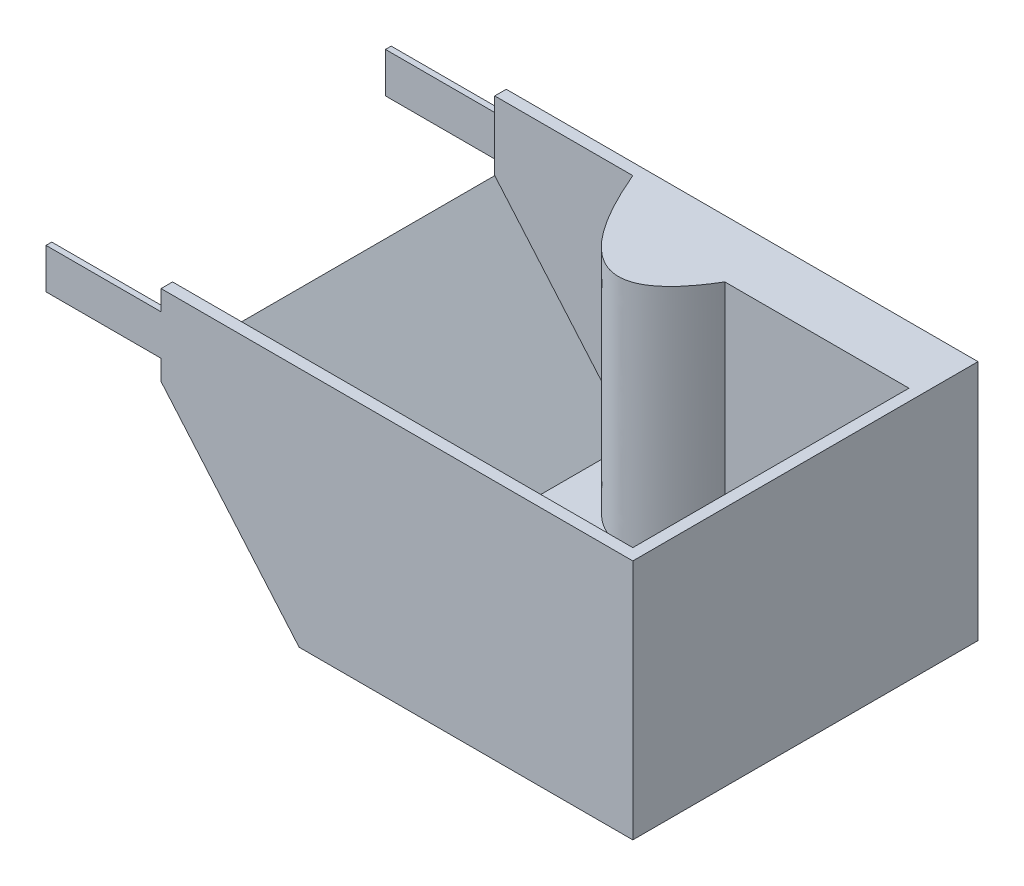
from build123d import *

# Parameters (mm, degrees)
SALIENTE_EXTRUIR1_DEPTH    = 105
SALIENTE_EXTRUIR2_DEPTH    = 5
CROQUIS3_W                 = 140
CROQUIS3_H                 = 105
SALIENTE_EXTRUIR3_DEPTH    = 5
CROQUIS4_W                 = 205
CROQUIS4_H                 = 105
SALIENTE_EXTRUIR5_DEPTH    = 5
CROQUIS5_W                 = 205
CROQUIS5_H                 = 105
SALIENTE_EXTRUIR6_DEPTH    = 5
SALIENTE_EXTRUIR7_DEPTH    = 140
CORTAR_EXTRUIR1_DEPTH      = 273.167228172
CORTAR_EXTRUIR1_DEPTH_BACK = 273.167228172
CROQUIS9_W                 = 70
CROQUIS9_H                 = 17.5
SALIENTE_EXTRUIR8_DEPTH    = 2.5
CROQUIS10_W                = 70
CROQUIS10_H                = 17.5
SALIENTE_EXTRUIR9_DEPTH    = 2.5
CORTAR_EXTRUIR2_START      = -5
CORTAR_EXTRUIR2_DEPTH      = 140


with BuildPart() as part:
    # Croquis2 → Saliente-Extruir1 (new body)
    with BuildSketch(Plane(origin=(0, 0, 0), x_dir=(1, 0, 0), z_dir=(0, 1, 0))):
        with BuildLine():
            Line((120, 70), (60, 70))
            add(Edge.make_bspline(
                [(60, 70), (89.76394683, -0.562785514), (120, 50)],
                knots=[0, 0, 0, 1, 1, 1], degree=2))
            Line((120, 50), (200, 50))
            Line((200, 50), (200, 70))
            Line((200, 70), (120, 70))
        make_face()
    extrude(amount=SALIENTE_EXTRUIR1_DEPTH)

    # Croquis2<3> → Saliente-Extruir2 (add)
    with BuildSketch(Plane(origin=(0, 0, 0), x_dir=(1, 0, 0), z_dir=(0, 1, 0))):
        with BuildLine():
            Line((60, 70), (60, -70))
            Line((60, -70), (200, -70))
            Line((200, -70), (200, 50))
            Line((200, 50), (120, 50))
            add(Edge.make_bspline(
                [(60, 70), (89.76394683, -0.562785514), (120, 50)],
                knots=[0, 0, 0, 1, 1, 1], degree=2))
        make_face()
    extrude(amount=SALIENTE_EXTRUIR2_DEPTH)

    # Croquis3 → Saliente-Extruir3 (add)
    with BuildSketch(Plane(origin=(200, 0, 0), x_dir=(0, 0, -1), z_dir=(1, 0, 0))):
        with Locations((0, 52.5)):
            Rectangle(CROQUIS3_W, CROQUIS3_H)
    extrude(amount=SALIENTE_EXTRUIR3_DEPTH)

    # Croquis4 → Saliente-Extruir5 (add)
    with BuildSketch(Plane.XY.offset(70)):
        with Locations((102.5, 52.5)):
            Rectangle(CROQUIS4_W, CROQUIS4_H)
    extrude(amount=SALIENTE_EXTRUIR5_DEPTH)

    # Croquis5 → Saliente-Extruir6 (add)
    with BuildSketch(Plane(origin=(0, 0, -70), x_dir=(-1, 0, 0), z_dir=(0, 0, -1))):
        with Locations((-102.5, 52.5)):
            Rectangle(CROQUIS5_W, CROQUIS5_H)
    extrude(amount=SALIENTE_EXTRUIR6_DEPTH)

    # Croquis6 → Saliente-Extruir7 (add)
    with BuildSketch(Plane.XY.offset(-70)):
        Polygon((60, 5), (0, 75), (0, 70), (60, 0), align=None)
    extrude(amount=SALIENTE_EXTRUIR7_DEPTH)

    # Croquis8 → Cortar-Extruir1 (cut, two sides: drawn at the far end of the back side and taken through both)
    with BuildSketch(Plane.XY.offset(-70).offset(-CORTAR_EXTRUIR1_DEPTH_BACK)):
        Polygon((60, 0), (0, 70), (0, 0), align=None)
    extrude(amount=CORTAR_EXTRUIR1_DEPTH + CORTAR_EXTRUIR1_DEPTH_BACK, mode=Mode.SUBTRACT)

    # Croquis9 → Saliente-Extruir8 (add)
    with BuildSketch(Plane.XY.offset(75)):
        with Locations((-15, 87.5)):
            Rectangle(CROQUIS9_W, CROQUIS9_H)
    extrude(amount=-SALIENTE_EXTRUIR8_DEPTH)

    # Croquis10 → Saliente-Extruir9 (add)
    with BuildSketch(Plane(origin=(0, 0, -75), x_dir=(-1, 0, 0), z_dir=(0, 0, -1))):
        with Locations((15, 87.5)):
            Rectangle(CROQUIS10_W, CROQUIS10_H)
    extrude(amount=-SALIENTE_EXTRUIR9_DEPTH)

    # Croquis11 → Cortar-Extruir2 (cut)
    with BuildSketch(Plane(origin=(0, 105, 0), x_dir=(1, 0, 0), z_dir=(0, 1, 0)).offset(CORTAR_EXTRUIR2_START)):
        with BuildLine():
            Line((65.571134008, 70), (195, 70))
            Line((195, 70), (195, 55))
            Line((195, 55), (117.1633318, 55))
            add(Edge.make_bspline(
                [(117.1633318, 55), (116.553479191, 53.981059511), (115.34399458, 51.951404655), (113.624065501, 49.181454683), (110.189825419, 44.210450859), (105.056898876, 38.454652942), (100.423455416, 35.264929664), (97.501660631, 34.185491141), (95.327997633, 33.847005409), (93.19350491, 33.972145162), (90.391223635, 34.735002625), (85.948013808, 37.366168652), (78.790008493, 44.736062985), (74.164523658, 52.513426841)],
                knots=[-0.028793704, -0.028793704, -0.028793704, -0.004727786, 0.019338133, 0.06746997, 0.163733644, 0.292085209, 0.388348883, 0.452524666, 0.516700448, 0.580876231, 0.677139905, 0.80549147, 0.998018818, 0.998018818, 0.998018818], degree=2))
            Line((74.164523658, 52.513426841), (65.571134008, 70))
        make_face()
    extrude(amount=-CORTAR_EXTRUIR2_DEPTH, mode=Mode.SUBTRACT)


solid = part.part
